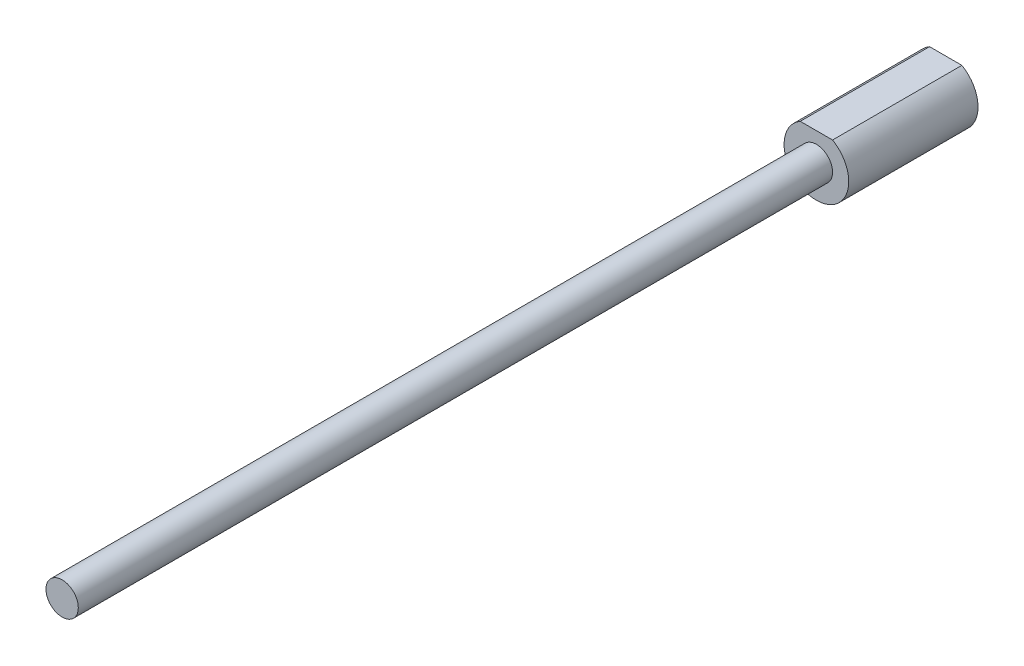
from build123d import *

# Parameters (mm, degrees)
EXTRUDE_1_DEPTH      = 4
EXTRUDE_1_DEPTH_BACK = 2
SKETCH_3_R           = 0.75
EXTRUDE_2_DEPTH      = 35


with BuildPart() as part:
    # Эскиз2 → Бобышка-Вытянуть1 (new, two sides: drawn at the far end of the back side and taken through both)
    with BuildSketch(Plane(origin=(0, 0, -28.1), x_dir=(-1, 0, 0), z_dir=(0, 0, -1)).offset(-EXTRUDE_1_DEPTH_BACK)):
        with BuildLine():
            Line((-0.75, 1.299038106), (0.75, 1.299038106))
            ThreePointArc((0.75, 1.299038106), (0, -1.5), (-0.75, 1.299038106))
        make_face()
    extrude(amount=EXTRUDE_1_DEPTH + EXTRUDE_1_DEPTH_BACK)

    # Эскиз3 → Бобышка-Вытянуть2 (add)
    with BuildSketch(Plane.XY.offset(-26.1)):
        Circle(SKETCH_3_R)
    extrude(amount=EXTRUDE_2_DEPTH)


solid = part.part
